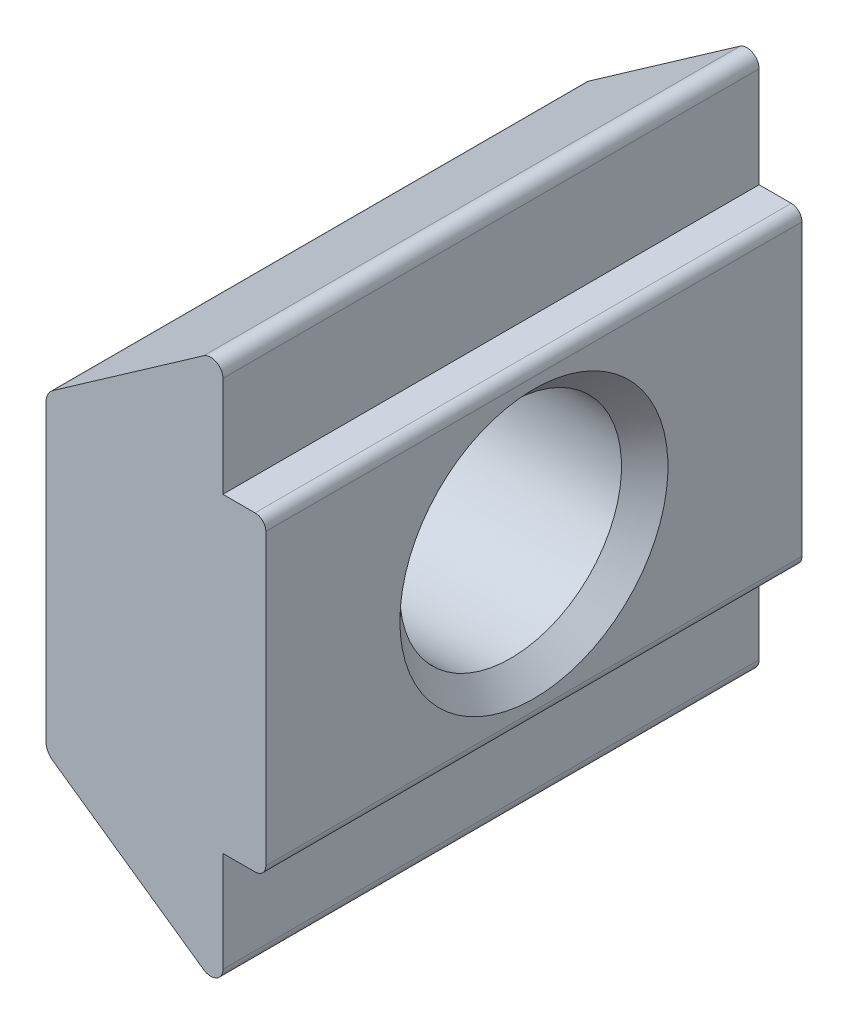
from build123d import *

# Parameters (mm, degrees)
BOSS_EXTRUDE1_DEPTH      = 5
BOSS_EXTRUDE1_DEPTH_BACK = 5


with BuildPart() as part:
    # Sketch1 → Boss-Extrude1 (new, two sides: drawn at the far end of the back side and taken through both)
    with BuildSketch(Plane.XY.offset(-BOSS_EXTRUDE1_DEPTH_BACK)):
        with BuildLine():
            Line((-3.972038703, -2.989572908), (-1.15890604, -4.958765772))
            ThreePointArc((-1.15890604, -4.958765772), (-0.922761342, -4.974218454), (-0.8, -4.7719))
            Line((-0.8, -4.7719), (-0.8, -2.9))
            Line((-0.8, -2.9), (-0.2, -2.9))
            ThreePointArc((-0.2, -2.9), (-0.058578644, -2.841421356), (0, -2.7))
            Line((0, -2.7), (0, 2.7))
            ThreePointArc((0, 2.7), (-0.058578644, 2.841421356), (-0.2, 2.9))
            Line((-0.2, 2.9), (-0.8, 2.9))
            Line((-0.8, 2.9), (-0.8, 4.7719))
            ThreePointArc((-0.8, 4.7719), (-0.922761342, 4.974218454), (-1.15890604, 4.958765772))
            Line((-1.15890604, 4.958765772), (-3.972038703, 2.989572908))
            ThreePointArc((-3.972038703, 2.989572908), (-4.066093603, 2.882346446), (-4.1, 2.743803332))
            Line((-4.1, 2.743803332), (-4.1, -2.743803332))
            ThreePointArc((-4.1, -2.743803332), (-4.066093603, -2.882346446), (-3.972038703, -2.989572908))
        make_face()
    extrude(amount=BOSS_EXTRUDE1_DEPTH + BOSS_EXTRUDE1_DEPTH_BACK)

    # Sketch2 → Cut-Revolve1 (revolve, cut)
    with BuildSketch(Plane.XY):
        Polygon((-4.1, 0), (-4.1, 2.5), (-3.667, 2.067), (-0.433, 2.067), (0, 2.5), (0, 0), align=None)
    revolve(axis=Axis((0, 0, 0), (-1, 0, 0)), mode=Mode.SUBTRACT)


solid = part.part
